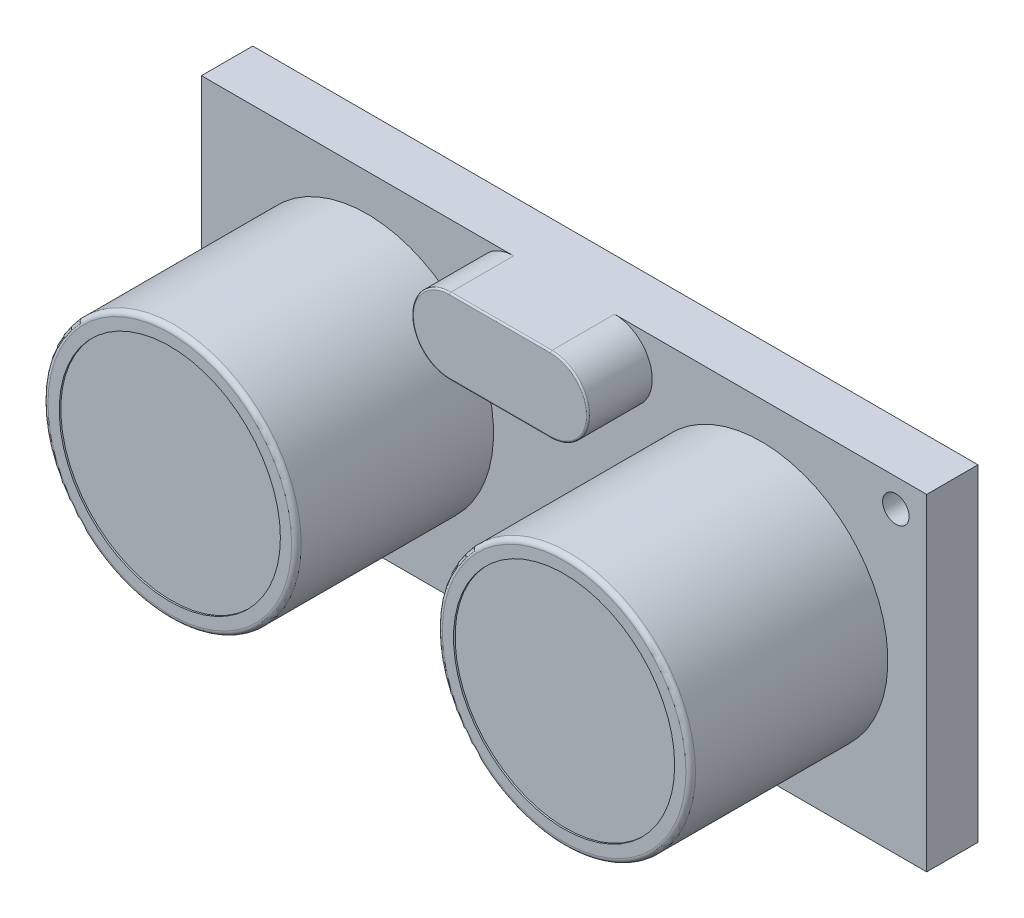
from build123d import *

# Parameters (mm, degrees)
SKETCH_1_W          = 45.25
SKETCH_1_H          = 20.4
EXTRUDE_1_DEPTH     = 3.2
EXTRUDE_2_DEPTH     = 4
FILLET_1_R          = 0.1
SKETCH_3_R          = 7.9
EXTRUDE_3_DEPTH     = 12.3
SKETCH_4_R          = 6.9
CUT_EXTRUDE_1_DEPTH = 0.1
FILLET_2_R          = 0.3
SKETCH_5_W          = 10.605065306
SKETCH_5_H          = 0.750801084
EXTRUDE_4_DEPTH     = 1
SKETCH_6_W          = 10.3
SKETCH_6_H          = 2.5
EXTRUDE_5_DEPTH     = 4.5
SKETCH_7_R          = 0.600934077
EXTRUDE_6_DEPTH     = 8
SKETCH_8_R          = 0.825
CUT_EXTRUDE_2_DEPTH = 10


with BuildPart() as part:
    # Эскиз1 → Бобышка-Вытянуть1 (new body)
    with BuildSketch(Plane.XY):
        Rectangle(SKETCH_1_W, SKETCH_1_H)
    extrude(amount=EXTRUDE_1_DEPTH)

    # Эскиз2 → Бобышка-Вытянуть2 (add)
    with BuildSketch(Plane.XY.offset(3.2)):
        with BuildLine():
            Line((-3.15, 10.2), (3.15, 10.2))
            ThreePointArc((3.15, 10.2), (5.5, 7.85), (3.15, 5.5))
            Line((3.15, 5.5), (-3.15, 5.5))
            ThreePointArc((-3.15, 5.5), (-5.5, 7.85), (-3.15, 10.2))
        make_face()
    extrude(amount=EXTRUDE_2_DEPTH)

    # Скругление1
    fillet_1_edges = [part.edges().sort_by_distance(p)[0] for p in [
        (-5.5, 7.85, 7.2),
        (0, 5.5, 7.2),
        (5.5, 7.85, 7.2),
        (0, 10.2, 7.2),
    ]]
    fillet(fillet_1_edges, radius=FILLET_1_R)

    # Эскиз3 → Бобышка-Вытянуть3 (add)
    with BuildSketch(Plane.XY.offset(3.2)):
        with Locations(Location((-12.3, 0, 0), (0, 0, 180))):
            Circle(SKETCH_3_R)
        with Locations(Location((12.3, 0, 0), (0, 0, 180))):
            Circle(SKETCH_3_R)
    extrude(amount=EXTRUDE_3_DEPTH)

    # Эскиз4 → Вырез-Вытянуть1 (cut)
    with BuildSketch(Plane.XY.offset(15.5)):
        with Locations((-12.3, 0)):
            Circle(SKETCH_4_R)
        with Locations((12.3, 0)):
            Circle(SKETCH_4_R)
    extrude(amount=-CUT_EXTRUDE_1_DEPTH, mode=Mode.SUBTRACT)

    # Скругление2
    fillet_2_edges = [part.edges().sort_by_distance(p)[0] for p in [
        (-4.4, 0, 15.5),
        (20.2, 0, 15.5),
    ]]
    fillet(fillet_2_edges, radius=FILLET_2_R)

    # Эскиз5 → Бобышка-Вытянуть4 (add)
    with BuildSketch(Plane.XY.offset(3.2)):
        with Locations((0, -8.235349386)):
            Rectangle(SKETCH_5_W, SKETCH_5_H)
    extrude(amount=EXTRUDE_4_DEPTH)

    # Эскиз8 → Вырез-Вытянуть2 (cut)
    with BuildSketch(Plane(origin=(0, 0, 0), x_dir=(-1, 0, 0), z_dir=(0, 0, -1))):
        with Locations((-20.7, 8.45)):
            Circle(SKETCH_8_R)
        with Locations((20.7, -8.45)):
            Circle(SKETCH_8_R)
    extrude(amount=-CUT_EXTRUDE_2_DEPTH, mode=Mode.SUBTRACT)


with BuildPart() as body_2:
    # Эскиз6 → Бобышка-Вытянуть5 (new body)
    with BuildSketch(Plane(origin=(0, 0, 0), x_dir=(-1, 0, 0), z_dir=(0, 0, -1))):
        with Locations((0, -8.95)):
            Rectangle(SKETCH_6_W, SKETCH_6_H)
    extrude(amount=EXTRUDE_5_DEPTH)

    # Эскиз7 → Бобышка-Вытянуть6 (add)
    with BuildSketch(Plane.XZ.offset(10.2)):
        with Locations(Location((-3.894780621, -3.533075537, 0), (0, 0, 90))):
            Circle(SKETCH_7_R)
        with Locations(Location((-1.394780621, -3.533075537, 0), (0, 0, 90))):
            Circle(SKETCH_7_R)
        with Locations(Location((1.105219379, -3.533075537, 0), (0, 0, 90))):
            Circle(SKETCH_7_R)
        with Locations(Location((3.605219379, -3.533075537, 0), (0, 0, 90))):
            Circle(SKETCH_7_R)
    extrude(amount=EXTRUDE_6_DEPTH)


solid = Compound([part.part, body_2.part])
